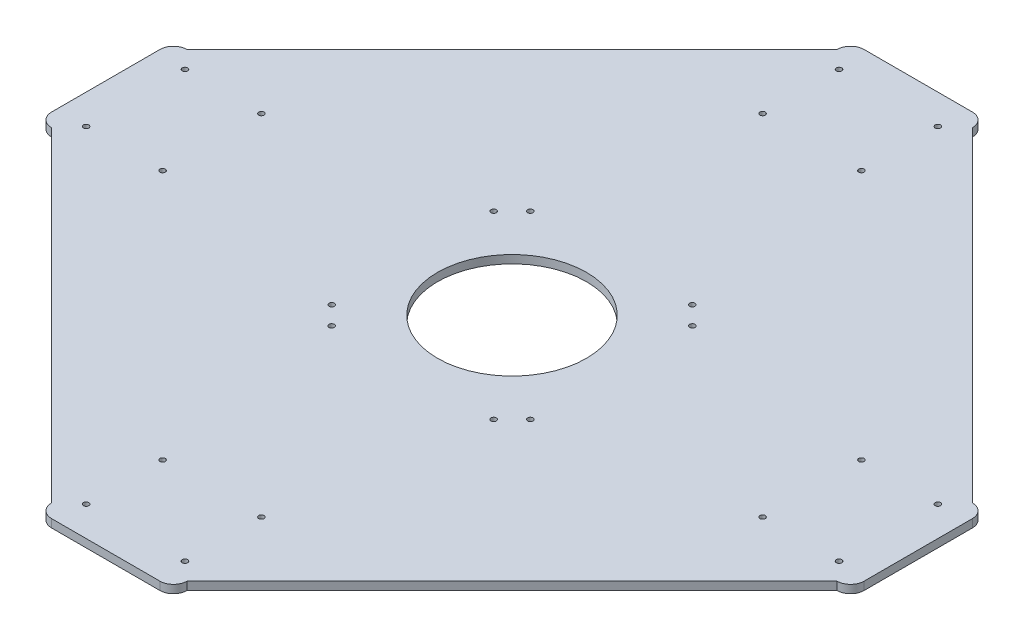
from build123d import *

# Parameters (mm, degrees)
BOSS_EXTRUDE1_DEPTH       = 6
SKETCH4_R                 = 0.495653738
CUT_EXTRUDE3_DEPTH        = 10
BOSS_EXTRUDE3_DEPTH       = 6
SKETCH6_R                 = 2
SKETCH6_R_2               = 4
CUT_EXTRUDE4_DEPTH        = 12
CIRPATTERN1_COUNT         = 4
BOSS_EXTRUDE4_DEPTH       = 6
F_4_0MM_DOWEL_HOLE5_D     = 4
F_4_0MM_DOWEL_HOLE5_DEPTH = 25.4
F_4_0MM_DOWEL_HOLE5_TIP   = 1.201721238
F_4_0MM_DOWEL_HOLE4_D     = 4
F_4_0MM_DOWEL_HOLE4_DEPTH = 98.31
F_4_0MM_DOWEL_HOLE4_TIP   = 1.201721238
SKETCH31_R                = 55
CUT_EXTRUDE7_DEPTH        = 22
SKETCH32_R                = 3.837227577
SKETCH32_R_2              = 3.691246821
SKETCH32_R_3              = 4.005777273
SKETCH32_R_4              = 3.413782358
SKETCH32_R_5              = 2.946286388
SKETCH32_R_6              = 2.662859758
SKETCH32_R_7              = 3.21029216
SKETCH32_R_8              = 3.304223232
SKETCH32_R_9              = 3.416276983
SKETCH32_R_10             = 5.576814982
SKETCH32_R_11             = 3.327214885
SKETCH32_R_12             = 3.217650006
SKETCH32_R_13             = 3.084152149
SKETCH32_R_14             = 2.850354754
SKETCH32_R_15             = 3.581653386
SKETCH32_R_16             = 3.209735743
SKETCH32_R_17             = 5.223630371
SKETCH32_R_18             = 3.239996293
SKETCH32_R_19             = 6.217574628
SKETCH32_R_20             = 3.281482388
SKETCH32_R_21             = 4.010466873
SKETCH32_R_22             = 4.080831309
SKETCH32_R_23             = 4.290737966
SKETCH32_R_24             = 4.085305416
SKETCH32_R_25             = 4.488085615
SKETCH32_R_26             = 4.89911642
SKETCH32_R_27             = 5.474778022
SKETCH32_R_28             = 7.813771611
SKETCH32_R_29             = 3.187569437
SKETCH32_R_30             = 2.929784552
SKETCH32_R_31             = 4.009606332
SKETCH32_R_32             = 4.090801563
BOSS_EXTRUDE5_DEPTH       = 6


with BuildPart() as part:
    # Sketch1 → Boss-Extrude1 (new body)
    with BuildSketch(Plane(origin=(0, 0, 0), x_dir=(1, 0, 0), z_dir=(0, 1, 0))):
        with BuildLine():
            Line((-110, 50), (-300, 50))
            ThreePointArc((-300, 50), (-307.071067812, 47.071067812), (-310, 40))
            Line((-310, 40), (-310, -40))
            ThreePointArc((-310, -40), (-307.071067812, -47.071067812), (-300, -50))
            Line((-300, -50), (-110, -50))
            Line((-110, -50), (-60, -100))
            Line((-60, -100), (-60, -290))
            ThreePointArc((-60, -290), (-57.071067812, -297.071067812), (-50, -300))
            Line((-50, -300), (30, -300))
            ThreePointArc((30, -300), (37.071067812, -297.071067812), (40, -290))
            Line((40, -290), (40, -100))
            Line((40, -100), (90, -50))
            Line((90, -50), (280, -50))
            ThreePointArc((280, -50), (287.071067812, -47.071067812), (290, -40))
            Line((290, -40), (290, 40))
            ThreePointArc((290, 40), (287.071067812, 47.071067812), (280, 50))
            Line((280, 50), (90, 50))
            Line((90, 50), (40, 100))
            Line((40, 100), (40, 290))
            ThreePointArc((40, 290), (37.071067812, 297.071067812), (30, 300))
            Line((30, 300), (-50, 300))
            ThreePointArc((-50, 300), (-57.071067812, 297.071067812), (-60, 290))
            Line((-60, 290), (-60, 100))
            Line((-60, 100), (-110, 50))
        make_face()
    extrude(amount=BOSS_EXTRUDE1_DEPTH)

    # Sketch4 → Cut-Extrude3 (cut)
    with BuildSketch(Plane(origin=(0, 6, 0), x_dir=(1, 0, 0), z_dir=(0, 1, 0))):
        with Locations(Location((-10, 0, 0), (0, 0, 270))):
            Circle(SKETCH4_R)
    extrude(amount=-CUT_EXTRUDE3_DEPTH, mode=Mode.SUBTRACT)

    # Sketch5 → Boss-Extrude3 (add)
    with BuildSketch(Plane(origin=(0, 6, 0), x_dir=(1, 0, 0), z_dir=(0, 1, 0))):
        Polygon((-300, 50), (-60, 290), (-60, 240), (-250, 50), align=None)
        Polygon((40, 290), (280, 50), (230, 50), (40, 240), align=None)
        Polygon((280, -50), (40, -290), (40, -240), (230, -49.07797178), align=None)
        Polygon((-300, -50), (-60, -290), (-60, -240), (-250, -50), align=None)
    extrude(amount=-BOSS_EXTRUDE3_DEPTH)

    # Sketch6 → Cut-Extrude4 (cut)
    with BuildSketch(Plane(origin=(0, 6, 0), x_dir=(1, 0, 0), z_dir=(0, 1, 0))):
        with Locations(Location((-37.824146891, 287.83697558, 0), (0, 0, 270))):
            Circle(SKETCH6_R)
        with Locations(Location((-37.824146891, 272.83697558, 0), (0, 0, 270))):
            Circle(SKETCH6_R)
        with Locations(Location((-46.483109463, 221.536893944, 0), (0, 0, 270))):
            Circle(SKETCH6_R)
        with Locations(Location((-46.483109463, 135.06793836, 0), (0, 0, 270))):
            Circle(SKETCH6_R)
        with Locations(Location((-69.817594081, 73.334484618, 0), (0, 0, 270))):
            Circle(SKETCH6_R)
        with Locations(Location((49.817594081, 73.334484618, 0), (0, 0, 270))):
            Circle(SKETCH6_R)
        with Locations(Location((26.483109463, 135.06793836, 0), (0, 0, 270))):
            Circle(SKETCH6_R)
        with Locations(Location((26.483109463, 221.536893944, 0), (0, 0, 270))):
            Circle(SKETCH6_R)
        with Locations(Location((191.360389693, 113.639610307, 0), (0, 0, 270))):
            Circle(SKETCH6_R)
        with Locations(Location((128.639610307, 176.360389693, 0), (0, 0, 270))):
            Circle(SKETCH6_R)
        with Locations(Location((17.824146891, 272.83697558, 0), (0, 0, 270))):
            Circle(SKETCH6_R)
        with Locations(Location((17.824146891, 287.83697558, 0), (0, 0, 270))):
            Circle(SKETCH6_R)
        with Locations(Location((-10, 0, 0), (0, 0, 270))):
            Circle(SKETCH6_R_2)
    cut_extrude4 = extrude(amount=-CUT_EXTRUDE4_DEPTH, mode=Mode.SUBTRACT)

    # CirPattern1: Cut-Extrude4 ×4 about axis
    cirpattern1_axis = Axis((-10, 0, 0), (0, 1, 0))
    for i in range(1, CIRPATTERN1_COUNT):
        add(cut_extrude4.rotate(cirpattern1_axis, i * 360 / CIRPATTERN1_COUNT), mode=Mode.SUBTRACT)

    # Sketch7 → Boss-Extrude4 (add)
    with BuildSketch(Plane(origin=(0, 6, 0), x_dir=(1, 0, 0), z_dir=(0, 1, 0))):
        Polygon((40, 240), (230, 50), (90, 50), (40, 100), align=None)
        Polygon((90, -50), (229.082424571, -50), (40, -240), (40, -100), align=None)
        Polygon((-60, 240), (-60, 100), (-110, 50), (-250, 50), align=None)
        Polygon((-110, -50), (-60, -100), (-60, -240), (-250, -50), align=None)
    extrude(amount=-BOSS_EXTRUDE4_DEPTH)

    # Ø4.0mm Dowel Hole5
    with Locations(Plane(origin=(0, 6, 0), x_dir=(1, 0, 0), z_dir=(0, 1, 0))):
        with Locations((-29.100763253, 23.781275186), (32.712886556, 23.781275186), (31.383087371, -32.5), (-30.430562437, -32.5)):
            Hole(F_4_0MM_DOWEL_HOLE5_D / 2, depth=F_4_0MM_DOWEL_HOLE5_DEPTH)
            with Locations((0, 0, -(F_4_0MM_DOWEL_HOLE5_DEPTH + F_4_0MM_DOWEL_HOLE5_TIP / 2))):  # 118° drill point
                Cone(0, F_4_0MM_DOWEL_HOLE5_D / 2, F_4_0MM_DOWEL_HOLE5_TIP, mode=Mode.SUBTRACT)

    # Ø4.0mm Dowel Hole4
    with Locations(Plane(origin=(0, 0, 0), x_dir=(-1, 0, 0), z_dir=(0, -1, 0))):
        with Locations((46.483109463, -278), (-26.483109463, -278), (-268, -36.483109463), (-268, 36.483109463), (-26.483109463, 278), (46.483109463, 278), (288, 36.483109463), (288, -36.483109463)):
            Hole(F_4_0MM_DOWEL_HOLE4_D / 2, depth=F_4_0MM_DOWEL_HOLE4_DEPTH)
            with Locations((0, 0, -(F_4_0MM_DOWEL_HOLE4_DEPTH + F_4_0MM_DOWEL_HOLE4_TIP / 2))):  # 118° drill point
                Cone(0, F_4_0MM_DOWEL_HOLE4_D / 2, F_4_0MM_DOWEL_HOLE4_TIP, mode=Mode.SUBTRACT)

    # Sketch31 → Cut-Extrude7 (cut)
    with BuildSketch(Plane.XZ):
        with Locations(Location((-10, 0, 0), (0, 0, 270))):
            Circle(SKETCH31_R)
    extrude(amount=-CUT_EXTRUDE7_DEPTH, mode=Mode.SUBTRACT)

    # Sketch32 → Boss-Extrude5 (add)
    with BuildSketch(Plane.XZ):
        with Locations((-148.639610307, 176.360389693)):
            Circle(SKETCH32_R)
        with Locations((-211.360389693, 113.639610307)):
            Circle(SKETCH32_R_2)
        with Locations((-282.83697558, 27.824146891)):
            Circle(SKETCH32_R_3)
        with Locations((-297.83697558, 27.824146891)):
            Circle(SKETCH32_R_4)
        with Locations((-297.83697558, -27.824146891)):
            Circle(SKETCH32_R_5)
        with Locations((-282.83697558, -27.824146891)):
            Circle(SKETCH32_R_6)
        with Locations((-145.06793836, -36.483109463)):
            Circle(SKETCH32_R_7)
        with Locations((-145.06793836, 36.457377156)):
            Circle(SKETCH32_R_8)
        with Locations((-186.360389693, -138.639610307)):
            Circle(SKETCH32_R_9)
        with Locations((-123.838638112, -202.788762732)):
            Circle(SKETCH32_R_10)
        with Locations((-37.824146891, -272.83697558)):
            Circle(SKETCH32_R_11)
        with Locations((-37.824146891, -287.83697558)):
            Circle(SKETCH32_R_12)
        with Locations((17.824146891, -287.83697558)):
            Circle(SKETCH32_R_13)
        with Locations((17.824146891, -272.83697558)):
            Circle(SKETCH32_R_14)
        with Locations((26.483109463, -135.06793836)):
            Circle(SKETCH32_R_15)
        with Locations((-46.483109463, -135.06793836)):
            Circle(SKETCH32_R_16)
        with Locations((128.639610307, -176.360389693)):
            Circle(SKETCH32_R_17)
        with Locations((125.06793836, -37.248921052)):
            Circle(SKETCH32_R_18)
        with Locations((190.399105171, -114.010951532)):
            Circle(SKETCH32_R_19)
        with Locations((125.253969426, 35.650797055)):
            Circle(SKETCH32_R_20)
        with Locations((277.982195025, 26.611427969)):
            Circle(SKETCH32_R_21)
        with Locations((262.862191843, 26.611427969)):
            Circle(SKETCH32_R_22)
        with Locations((261.817821155, -27.824146891)):
            Circle(SKETCH32_R_23)
        with Locations((277.008476777, -28.651243723)):
            Circle(SKETCH32_R_24)
        with Locations((25.470022372, 134.658293559)):
            Circle(SKETCH32_R_25)
        with Locations((-46.142219861, 134.074156368)):
            Circle(SKETCH32_R_26)
        with Locations((102.990893209, 200.50311812)):
            Circle(SKETCH32_R_27)
        with Locations((165.946806213, 137.06793836)):
            Circle(SKETCH32_R_28)
        with Locations((17.414125568, 272.231636603)):
            Circle(SKETCH32_R_29)
        with Locations((17.181225285, 287.538992514)):
            Circle(SKETCH32_R_30)
        with Locations((-38.293050813, 286.797735955)):
            Circle(SKETCH32_R_31)
        with Locations((-38.831274267, 271.695880736)):
            Circle(SKETCH32_R_32)
    extrude(amount=-BOSS_EXTRUDE5_DEPTH)


solid = part.part
